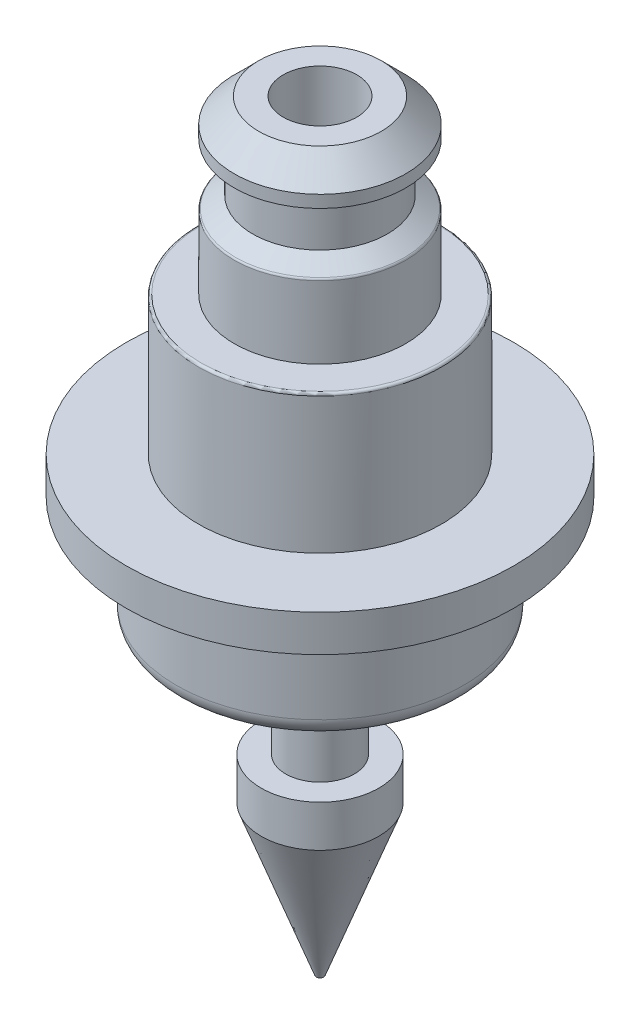
from build123d import *

# Parameters (mm, degrees)
FILLET1_R = 0.75
FILLET2_R = 0.1


with BuildPart() as part:
    # Sketch1 → Revolve1 (revolve)
    with BuildSketch(Plane.XY, mode=Mode.PRIVATE) as revolve1_sk:
        Polygon((1.5, 14.15), (2.5, 14.15), (3.5, 13.15), (3.5, 12.65), (2.75, 12.15), (2.75, 10.65), (3.5, 10.15), (3.5, 7.15), (4.955, 7.15), (4.955, 1.5), (7.9, 1.5), (7.9, 0), (5.85, 0), (5.85, -4.5), (1.4, -4.5), (1.4, -9.1), (2.4, -9.1), (2.4, -10.8), (0.15, -16.9), (0.15, 0), (1.5, 0), align=None)
    revolve(revolve1_sk.sketch.rotate(Axis((0, 0, 0), (0, 1, 0)), 90), axis=Axis((0, 0, 0), (0, 1, 0)))

    # Fillet1
    fillet1_edges = [part.edges().sort_by_distance(p)[0] for p in [
        (0, -4.5, 5.85),
    ]]
    fillet(fillet1_edges, radius=FILLET1_R)

    # Fillet2
    fillet2_edges = [part.edges().sort_by_distance(p)[0] for p in [
        (0, 7.15, 4.955),
        (0, 10.15, 3.5),
    ]]
    fillet(fillet2_edges, radius=FILLET2_R)


solid = part.part
